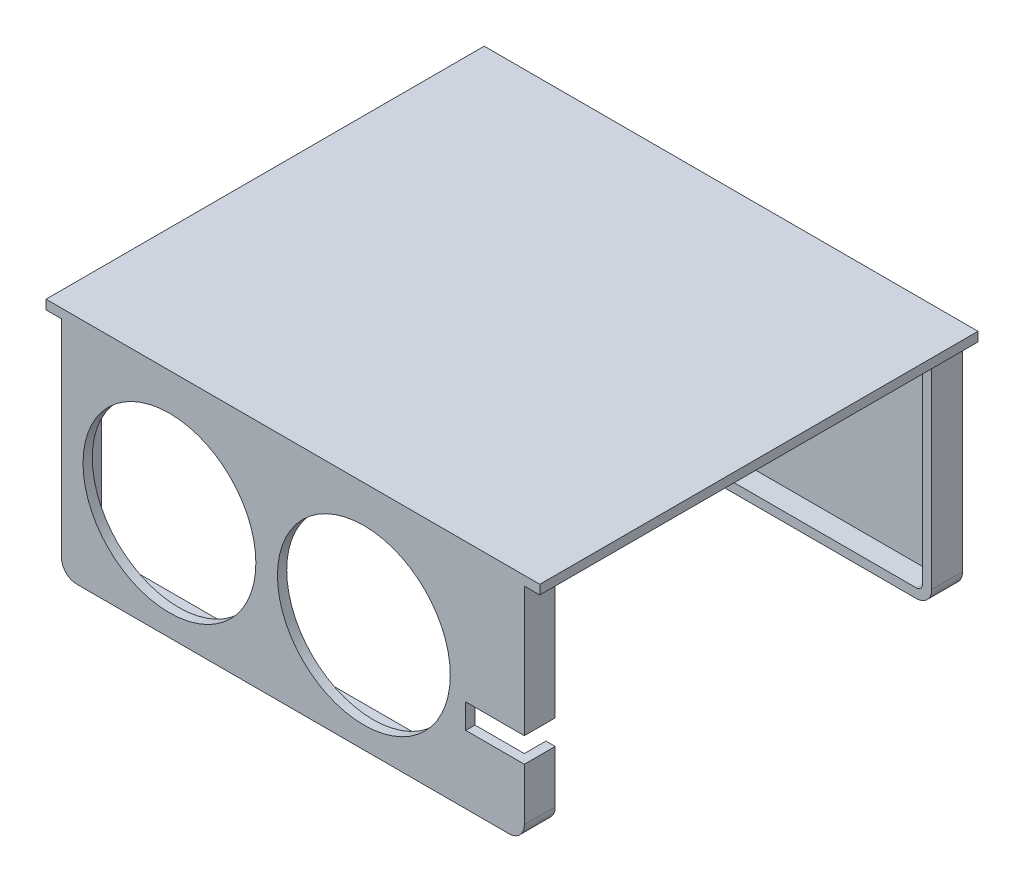
from build123d import *

# Parameters (mm, degrees)
SKETCH1_W                        = 160
SKETCH1_H                        = 142
ROOF_DEPTH                       = 3
SKETCH2_W                        = 150
SKETCH2_H                        = 3
FRONT_AND_REAR_WALLS_DEPTH       = 72
FILLET1_R                        = 5
FRONT_COVER_REINFORCEMENT_DEPTH  = 10
REAR_START                       = -10
REAR_COVER_REINFORCEMENT_DEPTH   = 10
SKETCH5_W                        = 19
SKETCH5_H                        = 8
DISPLAY_CABLE_PASSTHRU_CUT_DEPTH = 10
SKETCH6_R                        = 28
FAN_CUTOUTS_DEPTH                = 10


with BuildPart() as part:
    # Sketch1 → ROOF (new body)
    with BuildSketch(Plane(origin=(0, 0, 0), x_dir=(1, 0, 0), z_dir=(0, 1, 0))):
        with Locations((35, -39)):
            Rectangle(SKETCH1_W, SKETCH1_H)
    extrude(amount=ROOF_DEPTH)

    # Sketch2 → FRONT AND REAR WALLS (add)
    with BuildSketch(Plane(origin=(0, 0, 0), x_dir=(1, 0, 0), z_dir=(0, 1, 0))):
        with Locations((35, 30.5)):
            Rectangle(SKETCH2_W, SKETCH2_H)
        with Locations((35, -108.5)):
            Rectangle(SKETCH2_W, SKETCH2_H)
    extrude(amount=-FRONT_AND_REAR_WALLS_DEPTH)

    # Fillet1
    fillet1_edges = [part.edges().sort_by_distance(p)[0] for p in [
        (-40, -72, -30.5),
        (110, -72, -30.5),
        (-40, -72, 108.5),
        (110, -72, 108.5),
    ]]
    fillet(fillet1_edges, radius=FILLET1_R)

    # Sketch3 → FRONT COVER REINFORCEMENT (add)
    with BuildSketch(Plane.XY.offset(110)):
        with BuildLine():
            Line((110, -67), (110, 0))
            Line((110, 0), (107, 0))
            Line((107, 0), (107, -67))
            ThreePointArc((107, -67), (106.414213562, -68.414213562), (105, -69))
            Line((105, -69), (-35, -69))
            ThreePointArc((-35, -69), (-36.414213562, -68.414213562), (-37, -67))
            Line((-37, -67), (-37, 0))
            Line((-37, 0), (-40, 0))
            Line((-40, 0), (-40, -67))
            ThreePointArc((-40, -67), (-38.535533906, -70.535533906), (-35, -72))
            Line((-35, -72), (105, -72))
            ThreePointArc((105, -72), (108.535533906, -70.535533906), (110, -67))
        make_face()
    extrude(amount=-FRONT_COVER_REINFORCEMENT_DEPTH)

    # Sketch4 → REAR COVER REINFORCEMENT (add)
    with BuildSketch(Plane(origin=(0, 0, -32), x_dir=(-1, 0, 0), z_dir=(0, 0, -1)).offset(REAR_START)):
        with BuildLine():
            Line((-110, 0), (-110, -67))
            ThreePointArc((-110, -67), (-108.535533906, -70.535533906), (-105, -72))
            Line((-105, -72), (35, -72))
            ThreePointArc((35, -72), (38.535533906, -70.535533906), (40, -67))
            Line((40, -67), (40, 0))
            Line((40, 0), (37, 0))
            Line((37, 0), (37, -67))
            ThreePointArc((37, -67), (36.414213562, -68.414213562), (35, -69))
            Line((35, -69), (-105, -69))
            ThreePointArc((-105, -69), (-106.414213562, -68.414213562), (-107, -67))
            Line((-107, -67), (-107, 0))
            Line((-107, 0), (-110, 0))
        make_face()
    extrude(amount=REAR_COVER_REINFORCEMENT_DEPTH)

    # Sketch5 → DISPLAY CABLE PASSTHRU CUT (cut)
    with BuildSketch(Plane.XY.offset(110)):
        with Locations((100.5, -46)):
            Rectangle(SKETCH5_W, SKETCH5_H)
    extrude(amount=-DISPLAY_CABLE_PASSTHRU_CUT_DEPTH, mode=Mode.SUBTRACT)

    # Sketch6 → FAN CUTOUTS (cut)
    with BuildSketch(Plane.XY.offset(110)):
        with Locations((-5, -37)):
            Circle(SKETCH6_R)
        with Locations((58, -37)):
            Circle(SKETCH6_R)
    extrude(amount=-FAN_CUTOUTS_DEPTH, mode=Mode.SUBTRACT)


solid = part.part
